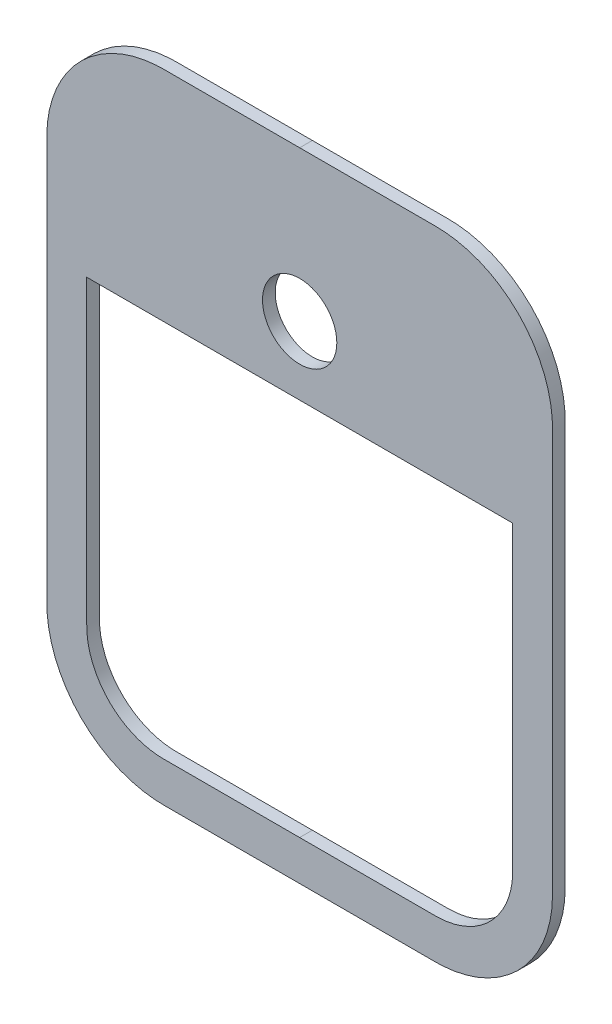
from build123d import *

# Parameters (mm, degrees)
SKETCH_1_R      = 8.2
EXTRUDE_1_DEPTH = 1.4


with BuildPart() as part:
    # Эскиз1 → Бобышка-Вытянуть1 (new, symmetric)
    # profile 1 of 2: a face of its own
    with BuildSketch(Plane.XY):
        with BuildLine():
            add(Edge.make_bspline(
                [(0, 136.805165198), (-2.37042379, 136.805165198), (-7.111336689, 136.805013871), (-14.222314124, 136.805694844), (-20.149271743, 136.803614095), (-24.888290367, 136.807851256), (-27.855974125, 136.797069193), (-30.216844907, 136.819200796), (-32.683364079, 136.720821225), (-35.703729814, 136.25434907), (-39.228411806, 135.192079334), (-43.674476779, 133.122170194), (-48.597790161, 129.389914704), (-52.272840964, 124.424095387), (-54.291822807, 119.954407038), (-55.312198083, 116.417828862), (-55.747863102, 113.39199914), (-55.809613711, 110.925168283), (-55.794454631, 108.578411347), (-55.801839763, 105.603851714), (-55.798937869, 100.867534615), (-55.800360366, 94.939254722), (-55.799905167, 87.828692261), (-55.8000569, 78.34676895), (-55.799962067, 66.494731483), (-55.8000569, 54.642694017), (-55.799905167, 45.160770705), (-55.800360366, 38.050208244), (-55.798937869, 32.121928351), (-55.801839763, 27.385611253), (-55.794454631, 24.41105162), (-55.809613711, 22.064294683), (-55.747863102, 19.597463826), (-55.312198083, 16.571634104), (-54.291822807, 13.035055928), (-52.272840964, 8.565367579), (-48.597790161, 3.599548262), (-43.674476779, -0.132707228), (-39.228411806, -2.202616368), (-35.703729814, -3.264886104), (-32.683364079, -3.731358259), (-30.216844907, -3.829737829), (-27.855974125, -3.807606227), (-24.888290367, -3.81838829), (-20.149271743, -3.814151128), (-14.222314124, -3.816231877), (-7.111336689, -3.815550905), (-2.37042379, -3.815702232), (0, -3.815702232)],
                knots=[0, 0, 0, 0, 0.03125, 0.0625, 0.09375, 0.109375, 0.125, 0.1328125, 0.140625, 0.15625, 0.171875, 0.1875, 0.21875, 0.25, 0.265625, 0.28125, 0.296875, 0.3046875, 0.3125, 0.328125, 0.34375, 0.375, 0.40625, 0.4375, 0.5, 0.5625, 0.59375, 0.625, 0.65625, 0.671875, 0.6875, 0.6953125, 0.703125, 0.71875, 0.734375, 0.75, 0.78125, 0.8125, 0.828125, 0.84375, 0.859375, 0.8671875, 0.875, 0.890625, 0.90625, 0.9375, 0.96875, 1, 1, 1, 1], degree=3))
            add(Edge.make_bspline(
                [(0, -3.815702232), (2.37042379, -3.815702232), (7.111336689, -3.815550905), (14.222314124, -3.816231877), (20.149271743, -3.814151128), (24.888290367, -3.81838829), (27.855974125, -3.807606227), (30.216844907, -3.829737829), (32.683364079, -3.731358259), (35.703729814, -3.264886104), (39.228411806, -2.202616368), (43.674476779, -0.132707228), (48.597790161, 3.599548262), (52.272840964, 8.565367579), (54.291822807, 13.035055928), (55.312198083, 16.571634104), (55.747863102, 19.597463826), (55.809613711, 22.064294683), (55.794454631, 24.41105162), (55.801839763, 27.385611253), (55.798937869, 32.121928351), (55.800360366, 38.050208244), (55.799905167, 45.160770705), (55.8000569, 54.642694017), (55.799962067, 66.494731483), (55.8000569, 78.34676895), (55.799905167, 87.828692261), (55.800360366, 94.939254722), (55.798937869, 100.867534615), (55.801839763, 105.603851714), (55.794454631, 108.578411347), (55.809613711, 110.925168283), (55.747863102, 113.39199914), (55.312198083, 116.417828862), (54.291822807, 119.954407038), (52.272840964, 124.424095387), (48.597790161, 129.389914704), (43.674476779, 133.122170194), (39.228411806, 135.192079334), (35.703729814, 136.25434907), (32.683364079, 136.720821225), (30.216844907, 136.819200796), (27.855974125, 136.797069193), (24.888290367, 136.807851256), (20.149271743, 136.803614095), (14.222314124, 136.805694844), (7.111336689, 136.805013871), (2.37042379, 136.805165198), (0, 136.805165198)],
                knots=[0, 0, 0, 0, 0.03125, 0.0625, 0.09375, 0.109375, 0.125, 0.1328125, 0.140625, 0.15625, 0.171875, 0.1875, 0.21875, 0.25, 0.265625, 0.28125, 0.296875, 0.3046875, 0.3125, 0.328125, 0.34375, 0.375, 0.40625, 0.4375, 0.5, 0.5625, 0.59375, 0.625, 0.65625, 0.671875, 0.6875, 0.6953125, 0.703125, 0.71875, 0.734375, 0.75, 0.78125, 0.8125, 0.828125, 0.84375, 0.859375, 0.8671875, 0.875, 0.890625, 0.90625, 0.9375, 0.96875, 1, 1, 1, 1], degree=3))
        make_face()
        with BuildLine():
            add(Edge.make_bspline(
                [(0, 4.984297768), (2.37042379, 4.984297768), (7.111276748, 4.984297736), (13.037316056, 4.984297855), (17.778203974, 4.984297618), (20.741131183, 4.984298219), (23.111765404, 4.984296986), (24.888940349, 4.984300752), (26.669171945, 4.984286613), (28.143176701, 4.984330606), (29.193638048, 4.984252104), (29.693381108, 4.984362158), (30.019976191, 4.984184709), (30.190434528, 4.98491178), (30.457102871, 4.989488256), (30.853917852, 5.003810956), (31.359926967, 5.03520674), (31.961162219, 5.094274236), (32.760894573, 5.201478452), (34.145142461, 5.462928318), (36.081410013, 6.047696592), (39.010301866, 7.411036383), (42.254095787, 9.870032114), (44.67625635, 13.142689017), (46.005496468, 16.086795153), (46.568001427, 18.029390949), (46.813468913, 19.41687133), (46.911496426, 20.217871664), (46.963639674, 20.820007508), (46.989223321, 21.325361879), (46.997721568, 21.674134537), (46.999616457, 21.855301499), (47.000027494, 21.947801949), (46.999966364, 22.14861745), (47.000012874, 22.498249155), (46.999992568, 23.083742615), (47.000002521, 23.827986136), (46.999999341, 24.715781241), (47.000000376, 25.901355742), (46.99999973, 27.975250245), (47.000000092, 30.938406753), (46.999999976, 34.494001915), (47.000000014, 39.23486276), (46.999999995, 45.160915726), (47.000000001, 52.272189184), (47, 59.383460003), (47, 66.494731483), (47, 73.606002963), (47.000000001, 80.669302332), (47, 85.954784691), (47, 90.695632571), (47.00000001, 94.299236223), (46.999999976, 98.495461052), (47.000000092, 102.051056214), (46.99999973, 105.014212722), (47.000000376, 107.088107224), (46.999999341, 108.273681725), (47.000002521, 109.16147683), (46.999992568, 109.905720351), (47.000012874, 110.491213812), (46.999966364, 110.840845516), (47.000027494, 111.041661017), (46.999616457, 111.134161467), (46.997721568, 111.31532843), (46.989223321, 111.664101087), (46.963639674, 112.169455459), (46.911496426, 112.771591302), (46.813468913, 113.572591637), (46.568001427, 114.960072017), (46.005496468, 116.902667814), (44.67625635, 119.846773949), (42.254095787, 123.119430852), (39.010301866, 125.578426583), (36.081410013, 126.941766374), (34.145142461, 127.526534649), (32.760894573, 127.787984514), (31.961162219, 127.89518873), (31.359926967, 127.954256226), (30.853917852, 127.98565201), (30.457102871, 127.99997471), (30.190434528, 128.004551186), (30.019976191, 128.005278257), (29.693381108, 128.005100808), (29.193638048, 128.005210862), (28.143176701, 128.00513236), (26.669171945, 128.005176354), (24.888940349, 128.005162214), (23.111765404, 128.00516598), (20.741131183, 128.005164747), (17.778203974, 128.005165348), (13.037316056, 128.005165112), (7.111276748, 128.00516523), (2.37042379, 128.005165198), (0, 128.005165198)],
                knots=[0, 0, 0, 0, 0.03125, 0.0625, 0.078125, 0.09375, 0.1015625, 0.109375, 0.1171875, 0.125, 0.12890625, 0.130859375, 0.131835938, 0.1328125, 0.134765625, 0.13671875, 0.140625, 0.14453125, 0.1484375, 0.15625, 0.171875, 0.1875, 0.21875, 0.25, 0.265625, 0.28125, 0.2890625, 0.29296875, 0.296875, 0.30078125, 0.302734375, 0.303710938, 0.304199219, 0.3046875, 0.306640625, 0.30859375, 0.3125, 0.31640625, 0.3203125, 0.328125, 0.34375, 0.359375, 0.375, 0.40625, 0.4375, 0.46875, 0.5, 0.53125, 0.5625, 0.593117578, 0.600930078, 0.625, 0.640625, 0.65625, 0.671875, 0.6796875, 0.68359375, 0.6875, 0.69140625, 0.693359375, 0.6953125, 0.695800781, 0.696289062, 0.697265625, 0.69921875, 0.703125, 0.70703125, 0.7109375, 0.71875, 0.734375, 0.75, 0.78125, 0.8125, 0.828125, 0.84375, 0.8515625, 0.85546875, 0.859375, 0.86328125, 0.865234375, 0.8671875, 0.868164062, 0.869140625, 0.87109375, 0.875, 0.8828125, 0.890625, 0.8984375, 0.90625, 0.921875, 0.9375, 0.96875, 1, 1, 1, 1], degree=3))
            add(Edge.make_bspline(
                [(0, 128.005165198), (-2.37042379, 128.005165198), (-7.111276748, 128.00516523), (-13.037316056, 128.005165112), (-17.778203974, 128.005165348), (-20.741131183, 128.005164747), (-23.111765404, 128.00516598), (-24.888940349, 128.005162214), (-26.669171945, 128.005176354), (-28.143176701, 128.00513236), (-29.193638048, 128.005210862), (-29.693381108, 128.005100808), (-30.019976191, 128.005278257), (-30.190434528, 128.004551186), (-30.457102871, 127.99997471), (-30.853917852, 127.98565201), (-31.359926967, 127.954256226), (-31.961162219, 127.89518873), (-32.760894573, 127.787984514), (-34.145142461, 127.526534649), (-36.081410013, 126.941766374), (-39.010301866, 125.578426583), (-42.254095787, 123.119430852), (-44.67625635, 119.846773949), (-46.005496468, 116.902667814), (-46.568001427, 114.960072017), (-46.813468913, 113.572591637), (-46.911496426, 112.771591302), (-46.963639674, 112.169455459), (-46.989223321, 111.664101087), (-46.997721568, 111.31532843), (-46.999616457, 111.134161467), (-47.000027494, 111.041661017), (-46.999966364, 110.840845516), (-47.000012874, 110.491213812), (-46.999992568, 109.905720351), (-47.000002521, 109.16147683), (-46.999999341, 108.273681725), (-47.000000376, 107.088107224), (-46.99999973, 105.014212722), (-47.000000092, 102.051056214), (-46.999999976, 98.495461052), (-47.00000001, 94.299236223), (-47, 90.695632571), (-47, 85.954784691), (-47.000000001, 80.669302332), (-47, 73.606002963), (-47, 66.494731483), (-47, 59.383460003), (-47.000000001, 52.272189184), (-46.999999995, 45.160915726), (-47.000000014, 39.23486276), (-46.999999976, 34.494001915), (-47.000000092, 30.938406753), (-46.99999973, 27.975250245), (-47.000000376, 25.901355742), (-46.999999341, 24.715781241), (-47.000002521, 23.827986136), (-46.999992568, 23.083742615), (-47.000012874, 22.498249155), (-46.999966364, 22.14861745), (-47.000027494, 21.947801949), (-46.999616457, 21.855301499), (-46.997721568, 21.674134537), (-46.989223321, 21.325361879), (-46.963639674, 20.820007508), (-46.911496426, 20.217871664), (-46.813468913, 19.41687133), (-46.568001427, 18.029390949), (-46.005496468, 16.086795153), (-44.67625635, 13.142689017), (-42.254095787, 9.870032114), (-39.010301866, 7.411036383), (-36.081410013, 6.047696592), (-34.145142461, 5.462928318), (-32.760894573, 5.201478452), (-31.961162219, 5.094274236), (-31.359926967, 5.03520674), (-30.853917852, 5.003810956), (-30.457102871, 4.989488256), (-30.190434528, 4.98491178), (-30.019976191, 4.984184709), (-29.693381108, 4.984362158), (-29.193638048, 4.984252104), (-28.143176701, 4.984330606), (-26.669171945, 4.984286613), (-24.888940349, 4.984300752), (-23.111765404, 4.984296986), (-20.741131183, 4.984298219), (-17.778203974, 4.984297618), (-13.037316056, 4.984297855), (-7.111276748, 4.984297736), (-2.37042379, 4.984297768), (0, 4.984297768)],
                knots=[0, 0, 0, 0, 0.03125, 0.0625, 0.078125, 0.09375, 0.1015625, 0.109375, 0.1171875, 0.125, 0.12890625, 0.130859375, 0.131835938, 0.1328125, 0.134765625, 0.13671875, 0.140625, 0.14453125, 0.1484375, 0.15625, 0.171875, 0.1875, 0.21875, 0.25, 0.265625, 0.28125, 0.2890625, 0.29296875, 0.296875, 0.30078125, 0.302734375, 0.303710938, 0.304199219, 0.3046875, 0.306640625, 0.30859375, 0.3125, 0.31640625, 0.3203125, 0.328125, 0.34375, 0.359375, 0.375, 0.399069922, 0.406882422, 0.4375, 0.46875, 0.5, 0.53125, 0.5625, 0.59375, 0.625, 0.640625, 0.65625, 0.671875, 0.6796875, 0.68359375, 0.6875, 0.69140625, 0.693359375, 0.6953125, 0.695800781, 0.696289062, 0.697265625, 0.69921875, 0.703125, 0.70703125, 0.7109375, 0.71875, 0.734375, 0.75, 0.78125, 0.8125, 0.828125, 0.84375, 0.8515625, 0.85546875, 0.859375, 0.86328125, 0.865234375, 0.8671875, 0.868164062, 0.869140625, 0.87109375, 0.875, 0.8828125, 0.890625, 0.8984375, 0.90625, 0.921875, 0.9375, 0.96875, 1, 1, 1, 1], degree=3))
        make_face(mode=Mode.SUBTRACT)
    # profile 2 of 2: a face of its own
    with BuildSketch(Plane.XY):
        with BuildLine():
            add(Edge.make_bspline(
                [(0, 128.005165198), (-2.37042379, 128.005165198), (-7.111276748, 128.00516523), (-13.037316056, 128.005165112), (-17.778203974, 128.005165348), (-20.741131183, 128.005164747), (-23.111765404, 128.00516598), (-24.888940349, 128.005162214), (-26.669171945, 128.005176354), (-28.143176701, 128.00513236), (-29.193638048, 128.005210862), (-29.693381108, 128.005100808), (-30.019976191, 128.005278257), (-30.190434528, 128.004551186), (-30.457102871, 127.99997471), (-30.853917852, 127.98565201), (-31.359926967, 127.954256226), (-31.961162219, 127.89518873), (-32.760894573, 127.787984514), (-34.145142461, 127.526534649), (-36.081410013, 126.941766374), (-39.010301866, 125.578426583), (-42.254095787, 123.119430852), (-44.67625635, 119.846773949), (-46.005496468, 116.902667814), (-46.568001427, 114.960072017), (-46.813468913, 113.572591637), (-46.911496426, 112.771591302), (-46.963639674, 112.169455459), (-46.989223321, 111.664101087), (-46.997721568, 111.31532843), (-46.999616457, 111.134161467), (-47.000027494, 111.041661017), (-46.999966364, 110.840845516), (-47.000012874, 110.491213812), (-46.999992568, 109.905720351), (-47.000002521, 109.16147683), (-46.999999341, 108.273681725), (-47.000000376, 107.088107224), (-46.99999973, 105.014212722), (-47.000000092, 102.051056214), (-46.999999976, 98.495461052), (-47.00000001, 94.299236223), (-47, 90.991935258), (-47, 88.869843121), (-47, 88.573540147)],
                knots=[0, 0, 0, 0, 0.03125, 0.0625, 0.078125, 0.09375, 0.1015625, 0.109375, 0.1171875, 0.125, 0.12890625, 0.130859375, 0.131835938, 0.1328125, 0.134765625, 0.13671875, 0.140625, 0.14453125, 0.1484375, 0.15625, 0.171875, 0.1875, 0.21875, 0.25, 0.265625, 0.28125, 0.2890625, 0.29296875, 0.296875, 0.30078125, 0.302734375, 0.303710938, 0.304199219, 0.3046875, 0.306640625, 0.30859375, 0.3125, 0.31640625, 0.3203125, 0.328125, 0.34375, 0.359375, 0.375, 0.399069922, 0.402976172, 0.402976172, 0.402976172, 0.402976172], degree=3))
            Line((-47, 88.573540147), (47, 88.573540147))
            add(Edge.make_bspline(
                [(47, 88.573540147), (47, 88.869843121), (47, 90.991935258), (47.00000001, 94.299236223), (46.999999976, 98.495461052), (47.000000092, 102.051056214), (46.99999973, 105.014212722), (47.000000376, 107.088107224), (46.999999341, 108.273681725), (47.000002521, 109.16147683), (46.999992568, 109.905720351), (47.000012874, 110.491213812), (46.999966364, 110.840845516), (47.000027494, 111.041661017), (46.999616457, 111.134161467), (46.997721568, 111.31532843), (46.989223321, 111.664101087), (46.963639674, 112.169455459), (46.911496426, 112.771591302), (46.813468913, 113.572591637), (46.568001427, 114.960072017), (46.005496468, 116.902667814), (44.67625635, 119.846773949), (42.254095787, 123.119430852), (39.010301866, 125.578426583), (36.081410013, 126.941766374), (34.145142461, 127.526534649), (32.760894573, 127.787984514), (31.961162219, 127.89518873), (31.359926967, 127.954256226), (30.853917852, 127.98565201), (30.457102871, 127.99997471), (30.190434528, 128.004551186), (30.019976191, 128.005278257), (29.693381108, 128.005100808), (29.193638048, 128.005210862), (28.143176701, 128.00513236), (26.669171945, 128.005176354), (24.888940349, 128.005162214), (23.111765404, 128.00516598), (20.741131183, 128.005164747), (17.778203974, 128.005165348), (13.037316056, 128.005165112), (7.111276748, 128.00516523), (2.37042379, 128.005165198), (0, 128.005165198)],
                knots=[0.597023828, 0.597023828, 0.597023828, 0.597023828, 0.600930078, 0.625, 0.640625, 0.65625, 0.671875, 0.6796875, 0.68359375, 0.6875, 0.69140625, 0.693359375, 0.6953125, 0.695800781, 0.696289062, 0.697265625, 0.69921875, 0.703125, 0.70703125, 0.7109375, 0.71875, 0.734375, 0.75, 0.78125, 0.8125, 0.828125, 0.84375, 0.8515625, 0.85546875, 0.859375, 0.86328125, 0.865234375, 0.8671875, 0.868164062, 0.869140625, 0.87109375, 0.875, 0.8828125, 0.890625, 0.8984375, 0.90625, 0.921875, 0.9375, 0.96875, 1, 1, 1, 1], degree=3))
        make_face()
        with Locations((0, 103.636945021)):
            Circle(SKETCH_1_R, mode=Mode.SUBTRACT)
    extrude(amount=EXTRUDE_1_DEPTH, both=True)


solid = part.part
